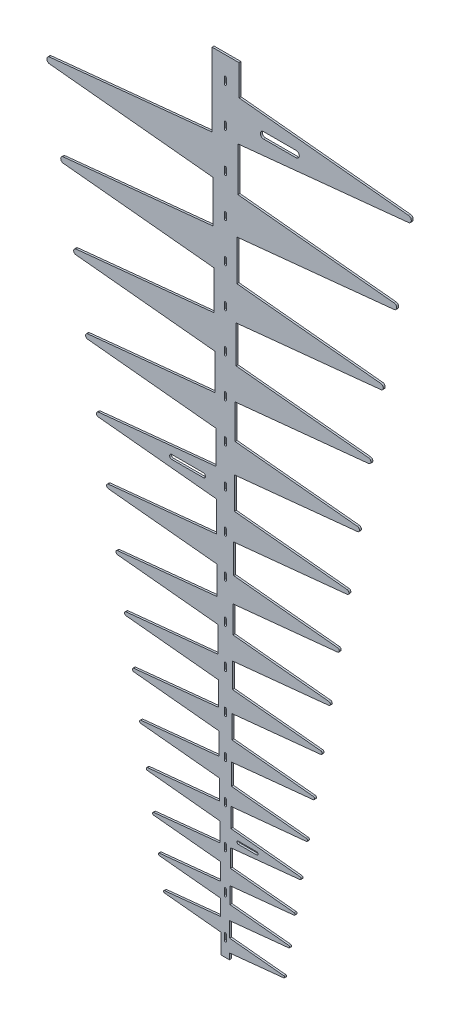
from build123d import *

# Parameters (mm, degrees)
EXTRUDE3_DEPTH       = 0.762
TAB_1_DEPTH          = 575.900497916
EXTRUDE7_DEPTH       = 575.900497916
TAB_1_600_X_29_COUNT = 29
TAB_1_600_X_29_PITCH = 15.24
EC_02_SHORTEN_DEPTH  = 575.900497916


with BuildPart() as part:
    # Sketch5 → Extrude3 (new body)
    with BuildSketch(Plane.XY):
        with BuildLine():
            Line((1.569723214, 128.800336437), (1.569723214, 128.477200401))
            Line((1.569723214, 128.477200401), (1.569723214, 126.445200401))
            Line((1.569723214, 126.445200401), (-1.639073902, 126.445200401))
            Line((-1.639073902, 126.445200401), (-1.639073902, 128.477200401))
            Line((-1.639073902, 128.477200401), (-1.639073902, 134.153349025))
            Line((-1.639073902, 134.153349025), (-23.745789278, 136.374636157))
            ThreePointArc((-23.745789278, 136.374636157), (-24.111558717, 136.778958013), (-23.745872831, 137.183355439))
            Line((-23.745872831, 137.183355439), (-1.778671536, 139.395209196))
            Line((-1.778671536, 139.395209196), (-1.778671536, 145.579002371))
            Line((-1.778671536, 145.579002371), (-25.773651417, 147.982550127))
            ThreePointArc((-25.773651417, 147.982550127), (-26.162413881, 148.412027515), (-25.773994655, 148.841815353))
            Line((-25.773994655, 148.841815353), (-1.929795328, 151.249501665))
            Line((-1.929795328, 151.249501665), (-1.929795328, 157.948037583))
            Line((-1.929795328, 157.948037583), (-27.953066669, 160.555805002))
            ThreePointArc((-27.953066669, 160.555805002), (-28.387546596, 161.035576184), (-27.953910003, 161.516109741))
            Line((-27.953910003, 161.516109741), (-2.095980346, 164.153189133))
            Line((-2.095980346, 164.153189133), (-2.095980346, 171.549789571))
            Line((-2.095980346, 171.549789571), (-30.385291214, 174.449848475))
            ThreePointArc((-30.385291214, 174.449848475), (-30.841483693, 174.956538337), (-30.382627786, 175.460817475))
            Line((-30.382627786, 175.460817475), (-2.272090151, 178.192956613))
            Line((-2.272090151, 178.192956613), (-2.272090151, 185.963856025))
            Line((-2.272090151, 185.963856025), (-32.922187144, 189.05502039))
            ThreePointArc((-32.922187144, 189.05502039), (-33.424914744, 189.61106826), (-32.922051311, 190.166993292))
            Line((-32.922051311, 190.166993292), (-2.46543711, 193.231127915))
            Line((-2.46543711, 193.231127915), (-2.46543711, 201.788732531))
            Line((-2.46543711, 201.788732531), (-35.719515304, 205.133460319))
            ThreePointArc((-35.719515304, 205.133460319), (-36.268108946, 205.73995234), (-35.719610145, 206.346530134))
            Line((-35.719610145, 206.346530134), (-2.675247482, 209.675383858))
            Line((-2.675247482, 209.675383858), (-2.675247482, 218.96109066))
            Line((-2.675247482, 218.96109066), (-38.758719081, 222.583502848))
            ThreePointArc((-38.758719081, 222.583502848), (-39.353153233, 223.240547337), (-38.758823879, 223.897686623))
            Line((-38.758823879, 223.897686623), (-2.902773059, 227.503044425))
            Line((-2.902773059, 227.503044425), (-2.902773059, 237.583385931))
            Line((-2.902773059, 237.583385931), (-42.062595342, 241.532188513))
            ThreePointArc((-42.062595342, 241.532188513), (-42.702441117, 242.239962369), (-42.062272236, 242.947443994))
            Line((-42.062272236, 242.947443994), (-3.149692214, 246.853367608))
            Line((-3.149692214, 246.853367608), (-3.149692214, 257.79298814))
            Line((-3.149692214, 257.79298814), (-45.62472326, 262.055735606))
            ThreePointArc((-45.62472326, 262.055735606), (-46.333495633, 262.839174424), (-45.624774157, 263.622659284))
            Line((-45.624774157, 263.622659284), (-3.417595208, 267.861294996))
            Line((-3.417595208, 267.861294996), (-3.417595208, 279.720055503))
            Line((-3.417595208, 279.720055503), (-49.519659274, 284.35720823))
            ThreePointArc((-49.519659274, 284.35720823), (-50.273972635, 285.191197125), (-49.519664995, 286.025191194))
            Line((-49.519664995, 286.025191194), (-3.708476878, 290.633403765))
            Line((-3.708476878, 290.633403765), (-3.708476878, 303.527859508))
            Line((-3.708476878, 303.527859508), (-53.731631065, 308.563798743))
            ThreePointArc((-53.731631065, 308.563798743), (-54.554439392, 309.473743695), (-53.731345117, 310.383429999))
            Line((-53.731345117, 310.383429999), (-4.023893447, 315.371806256))
            Line((-4.023893447, 315.371806256), (-4.023893447, 329.343772434))
            Line((-4.023893447, 329.343772434), (-58.301725013, 334.80237172))
            ThreePointArc((-58.301725013, 334.80237172), (-59.193202596, 335.787985372), (-58.301754122, 336.773625352))
            Line((-58.301754122, 336.773625352), (-4.366191157, 342.199412458))
            Line((-4.366191157, 342.199412458), (-4.366191157, 357.359827147))
            Line((-4.366191157, 357.359827147), (-63.247174674, 363.276272304))
            ThreePointArc((-63.247174674, 363.276272304), (-64.230178725, 364.363048521), (-63.247078119, 365.449737394))
            Line((-63.247078119, 365.449737394), (-4.737527262, 371.323609496))
            Line((-4.737527262, 371.323609496), (-4.737527262, 387.752588584))
            Line((-4.737527262, 387.752588584), (-68.641702878, 394.188480742))
            ThreePointArc((-68.641702878, 394.188480742), (-69.693023697, 395.351020919), (-68.641661251, 396.51352345))
            Line((-68.641661251, 396.51352345), (-5.140684593, 402.906511923))
            Line((-5.140684593, 402.906511923), (-5.140684593, 420.749823219))
            Line((-5.140684593, 420.749823219), (-74.47823429, 427.716963152))
            ThreePointArc((-74.47823429, 427.716963152), (-75.621262179, 428.980499675), (-74.478433932, 430.244216772))
            Line((-74.478433932, 430.244216772), (-5.578020551, 437.178428349))
            Line((-5.578020551, 437.178428349), (-5.578020551, 456.5444774))
            Line((-5.578020551, 456.5444774), (-80.821315584, 464.115691443))
            ThreePointArc((-80.821315584, 464.115691443), (-82.05559437, 465.480407838), (-80.821299986, 466.845110126))
            Line((-80.821299986, 466.845110126), (-6.052615486, 474.367704154))
            Line((-6.052615486, 474.367704154), (-6.052615486, 495.388668518))
            Line((-6.052615486, 495.388668518), (-87.687100191, 503.587902124))
            ThreePointArc((-87.687100191, 503.587902124), (-89.035936767, 505.078932171), (-87.687235169, 506.570084313))
            Line((-87.687235169, 506.570084313), (-6.567154159, 514.725069423))
            Line((-6.567154159, 514.725069423), (-6.567154159, 537.502136459))
            Line((-6.567154159, 537.502136459), (-95.144581221, 546.412963802))
            ThreePointArc((-95.144581221, 546.412963802), (-96.607468267, 548.03045593), (-95.144469923, 549.647847391))
            Line((-95.144469923, 549.647847391), (-6.92419411, 558.516613628))
            Line((-6.92419411, 558.516613628), (-6.92419411, 566.7248))
            Line((-6.92419411, 566.7248), (6.92419411, 566.7248))
            Line((6.92419411, 566.7248), (6.92419411, 536.144916239))
            Line((6.92419411, 536.144916239), (91.349206877, 527.651818876))
            ThreePointArc((91.349206877, 527.651818876), (92.743521093, 526.110146692), (91.349100795, 524.568570456))
            Line((91.349100795, 524.568570456), (6.304675952, 516.019071865))
            Line((6.304675952, 516.019071865), (6.304675952, 494.147522456))
            Line((6.304675952, 494.147522456), (84.173036415, 486.326552186))
            ThreePointArc((84.173036415, 486.326552186), (85.476149714, 484.886124127), (84.173283424, 483.445472645))
            Line((84.173283424, 483.445472645), (5.810365906, 475.561257224))
            Line((5.810365906, 475.561257224), (5.810365906, 455.398542583))
            Line((5.810365906, 455.398542583), (77.584922292, 448.176363795))
            ThreePointArc((77.584922292, 448.176363795), (78.77348705, 446.862211747), (77.584945668, 445.548038557))
            Line((77.584945668, 445.548038557), (5.354851175, 438.278724298))
            Line((5.354851175, 438.278724298), (5.354851175, 419.695216204))
            Line((5.354851175, 419.695216204), (71.501612993, 413.048691374))
            ThreePointArc((71.501612993, 413.048691374), (72.598919765, 411.835717048), (71.501845915, 410.622532053))
            Line((71.501845915, 410.622532053), (4.935070192, 403.920892923))
            Line((4.935070192, 403.920892923), (4.935070192, 386.77844576))
            Line((4.935070192, 386.77844576), (65.897962743, 380.638774942))
            ThreePointArc((65.897962743, 380.638774942), (66.903573946, 379.526623015), (65.897610548, 378.414789644))
            Line((65.897610548, 378.414789644), (4.548189074, 372.255818159))
            Line((4.548189074, 372.255818159), (4.548189074, 356.464097514))
            Line((4.548189074, 356.464097514), (60.722902617, 350.819582222))
            ThreePointArc((60.722902617, 350.819582222), (61.660185549, 349.783459876), (60.723021769, 348.747229758))
            Line((60.723021769, 348.747229758), (4.191480704, 343.060293537))
            Line((4.191480704, 343.060293537), (4.191480704, 328.517570757))
            Line((4.191480704, 328.517570757), (55.955740139, 323.31175576))
            ThreePointArc((55.955740139, 323.31175576), (56.824359318, 322.351298209), (55.955537577, 321.39102389))
            Line((55.955537577, 321.39102389), (3.862855324, 316.16327854))
            Line((3.862855324, 316.16327854), (3.862855324, 302.765637103))
            Line((3.862855324, 302.765637103), (51.569270497, 297.962929))
            ThreePointArc((51.569270497, 297.962929), (52.369223047, 297.07836447), (51.569199794, 296.193863885))
            Line((51.569199794, 296.193863885), (3.559866463, 291.36453676))
            Line((3.559866463, 291.36453676), (3.559866463, 279.018231061))
            Line((3.559866463, 279.018231061), (47.531970406, 274.595319292))
            ThreePointArc((47.531970406, 274.595319292), (48.263425784, 273.786535637), (47.531842326, 272.977867836))
            Line((47.531842326, 272.977867836), (3.280924845, 268.533990661))
            Line((3.280924845, 268.533990661), (3.280924845, 257.147618475))
            Line((3.280924845, 257.147618475), (43.793794722, 253.081791349))
            ThreePointArc((43.793794722, 253.081791349), (44.479703471, 252.323606784), (43.793808222, 251.565410006))
            Line((43.793808222, 251.565410006), (3.023603792, 247.473023838))
            Line((3.023603792, 247.473023838), (3.023603792, 236.985781273))
            Line((3.023603792, 236.985781273), (40.374973385, 233.219339649))
            ThreePointArc((40.374973385, 233.219339649), (40.991967536, 232.5369025), (40.374779366, 231.854640815))
            Line((40.374779366, 231.854640815), (2.786601849, 228.075116133))
            Line((2.786601849, 228.075116133), (2.786601849, 218.412776745))
            Line((2.786601849, 218.412776745), (37.209948205, 214.957024185))
            ThreePointArc((37.209948205, 214.957024185), (37.781519498, 214.325309742), (37.210166587, 213.693397777))
            Line((37.210166587, 213.693397777), (2.568249325, 210.203608113))
            Line((2.568249325, 210.203608113), (2.568249325, 201.282439414))
            Line((2.568249325, 201.282439414), (34.291664688, 198.091667194))
            ThreePointArc((34.291664688, 198.091667194), (34.817400264, 197.510407392), (34.291679397, 196.929134285))
            Line((34.291679397, 196.929134285), (2.366820865, 193.717284678))
            Line((2.366820865, 193.717284678), (2.366820865, 185.496006398))
            Line((2.366820865, 185.496006398), (31.606297347, 182.547107809))
            ThreePointArc((31.606297347, 182.547107809), (32.08617282, 182.015433192), (31.604373142, 181.485501651))
            Line((31.604373142, 181.485501651), (2.182435695, 178.625904021))
            Line((2.182435695, 178.625904021), (2.182435695, 171.111190745))
            Line((2.182435695, 171.111190745), (29.131253727, 168.348551525))
            ThreePointArc((29.131253727, 168.348551525), (29.587447952, 167.843066545), (29.130988201, 167.337821326))
            Line((29.130988201, 167.337821326), (2.010726384, 164.572005017))
            Line((2.010726384, 164.572005017), (2.010726384, 157.553161628))
            Line((2.010726384, 157.553161628), (26.843213436, 155.064721577))
            ThreePointArc((26.843213436, 155.064721577), (27.254826142, 154.609973515), (26.843558723, 154.154913156))
            Line((26.843558723, 154.154913156), (1.852619616, 151.631433915))
            Line((1.852619616, 151.631433915), (1.852619616, 145.215260383))
            Line((1.852619616, 145.215260383), (24.73011308, 142.923649873))
            ThreePointArc((24.73011308, 142.923649873), (25.118875564, 142.494111178), (24.730334322, 142.064372346))
            Line((24.730334322, 142.064372346), (1.707407095, 139.746218686))
            Line((1.707407095, 139.746218686), (1.707407095, 133.817093953))
            Line((1.707407095, 133.817093953), (22.806120063, 131.697091103))
            ThreePointArc((22.806120063, 131.697091103), (23.149028911, 131.31804205), (22.806203741, 130.938917314))
            Line((22.806203741, 130.938917314), (1.569723214, 128.800336437))
        make_face()
    extrude(amount=EXTRUDE3_DEPTH)

    # Sketch7 → Tab 1 (cut, through all)
    with BuildSketch(Plane.XY):
        with BuildLine():
            Line((-0.4064, 134.3914), (-0.4064, 132.1054))
            ThreePointArc((-0.4064, 132.1054), (0, 131.699), (0.4064, 132.1054))
            Line((0.4064, 132.1054), (0.4064, 134.3914))
            ThreePointArc((0.4064, 134.3914), (0, 134.7978), (-0.4064, 134.3914))
        make_face()
    tab_1 = extrude(amount=TAB_1_DEPTH, mode=Mode.SUBTRACT)

    # Sketch11 → Extrude7 (cut, through all)
    with BuildSketch(Plane.XY):
        with BuildLine():
            Line((5.08, 167.2209), (12.2936, 167.2209))
            ThreePointArc((12.2936, 167.2209), (12.8397, 167.767), (12.2936, 168.3131))
            Line((12.2936, 168.3131), (5.08, 168.3131))
            ThreePointArc((5.08, 168.3131), (4.5339, 167.767), (5.08, 167.2209))
        make_face()
        with BuildLine():
            Line((27.6352, 413.07004), (14.9352, 413.07004))
            ThreePointArc((14.9352, 413.07004), (13.6906, 411.82544), (14.9352, 410.58084))
            Line((14.9352, 410.58084), (27.6352, 410.58084))
            ThreePointArc((27.6352, 410.58084), (28.8798, 411.82544), (27.6352, 413.07004))
        make_face()
        with BuildLine():
            Line((-20.88896, 284.353), (-8.59536, 284.353))
            ThreePointArc((-8.59536, 284.353), (-7.75716, 285.1912), (-8.59536, 286.0294))
            Line((-8.59536, 286.0294), (-20.88896, 286.0294))
            ThreePointArc((-20.88896, 286.0294), (-21.72716, 285.1912), (-20.88896, 284.353))
        make_face()
    extrude(amount=EXTRUDE7_DEPTH, mode=Mode.SUBTRACT)

    # Tab 1 600 x 29: Tab 1 ×29
    with Locations(*[(0, i * TAB_1_600_X_29_PITCH, 0) for i in range(1, TAB_1_600_X_29_COUNT)]):
        add(tab_1, mode=Mode.SUBTRACT)

    # Sketch10 → EC-02 Shorten (cut, through all)
    with BuildSketch(Plane.XY):
        Polygon((-113.730344669, 588.324747841), (114.308825886, 588.324747841), (114.308825886, 431.5968), (-5.140684593, 431.5968), (-5.140684593, 420.749823219), (-113.730344669, 420.749823219), align=None)
    extrude(amount=EC_02_SHORTEN_DEPTH, mode=Mode.SUBTRACT)


solid = part.part
